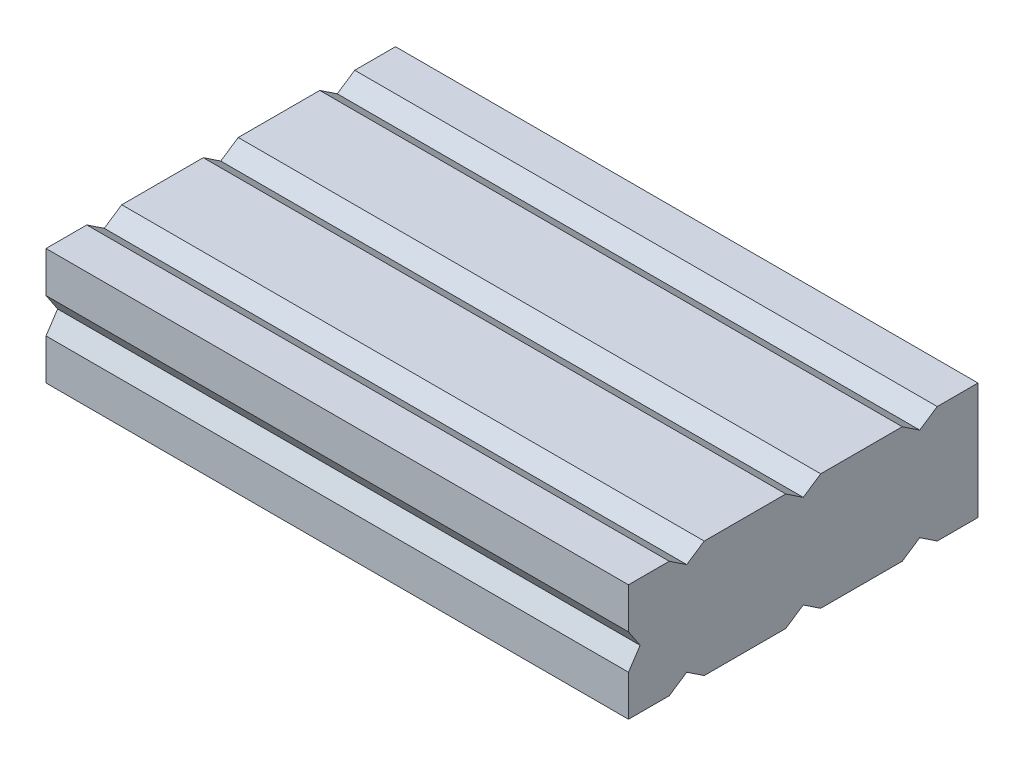
from build123d import *

# Parameters (mm, degrees)
AUFSATZ_LINEAR_AUSTRAGEN1_DEPTH = 100


with BuildPart() as part:
    # Skizze1 → Aufsatz-Linear austragen1 (new body)
    with BuildSketch(Plane(origin=(0, 0, 0), x_dir=(0, 0, -1), z_dir=(1, 0, 0))):
        Polygon((-40, -3), (-40, -10), (-33, -10), (-30, -8), (-27, -10), (-13, -10), (-10, -8), (-7, -10), (7, -10), (10, -8), (13, -10), (20, -10), (20, 10), (13, 10), (10, 8), (7, 10), (-7, 10), (-10, 8), (-13, 10), (-27, 10), (-30, 8), (-33, 10), (-40, 10), (-40, 3), (-38, 0), align=None)
    extrude(amount=AUFSATZ_LINEAR_AUSTRAGEN1_DEPTH)


solid = part.part
